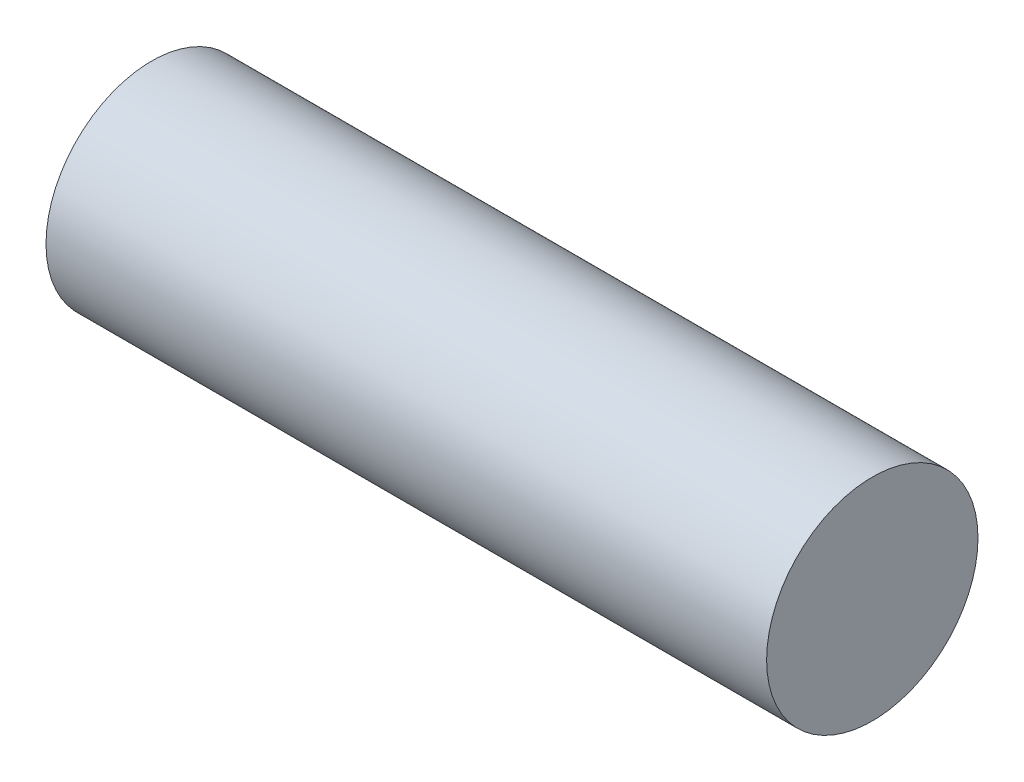
from build123d import *

# Parameters (mm, degrees)
SKETCH1_R           = 4.4
BOSS_EXTRUDE1_DEPTH = 30


with BuildPart() as part:
    # Sketch1 → Boss-Extrude1 (new body)
    with BuildSketch(Plane(origin=(0, 0, 0), x_dir=(0, 0, -1), z_dir=(1, 0, 0))):
        Circle(SKETCH1_R)
    extrude(amount=BOSS_EXTRUDE1_DEPTH)


solid = part.part
